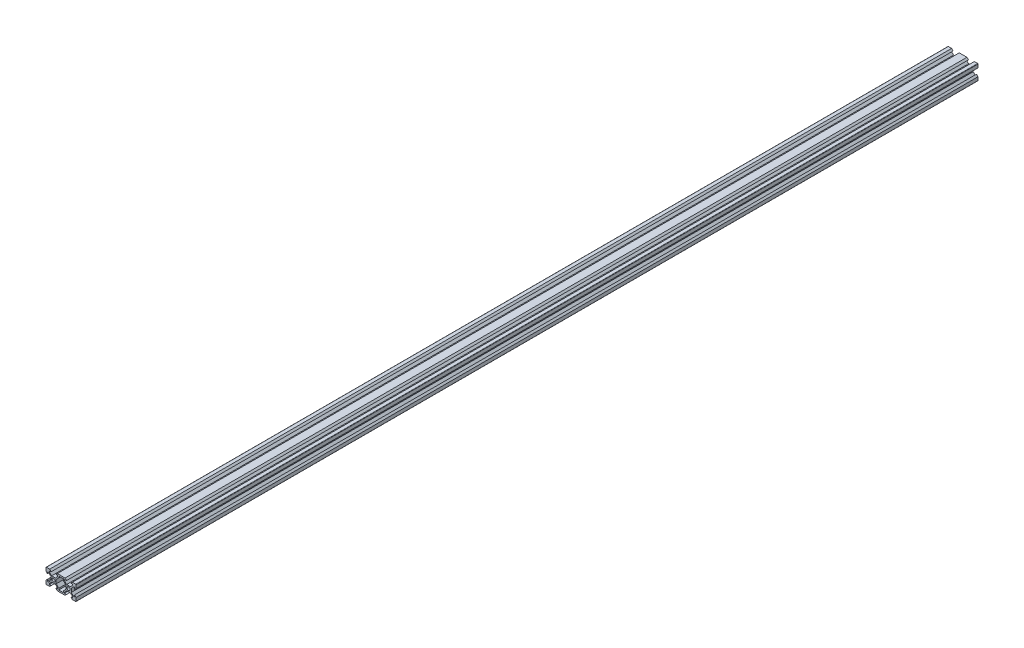
from build123d import *

# Parameters (mm, degrees)
SKETCH1_R           = 2.1
BOSS_EXTRUDE1_DEPTH = 1200
FILLET1_R           = 0.5


with BuildPart() as part:
    # Sketch1 → Boss-Extrude1 (new body)
    with BuildSketch(Plane.XY):
        Polygon((-20, -10), (-15.5, -10), (-15.1, -10), (-13.1, -8), (-15.5, -8), (-15.5, -6.560660172), (-12.539339828, -3.6), (-7.460660172, -3.6), (-4.5, -6.560660172), (-4.5, -8), (-6.9, -8), (-4.9, -10), (5.313777138, -10), (7.313777138, -8), (4.5, -8), (4.5, -6.560660172), (7.460660172, -3.6), (12.539339828, -3.6), (15.5, -6.560660172), (15.5, -8), (13.513777138, -8), (15.1, -10), (15.5, -10), (20, -10), (20, -5.5), (20, -5.1), (18, -3.1), (18, -5.5), (16.560660172, -5.5), (13.6, -2.539339828), (13.6, 2.539339828), (16.560660172, 5.5), (18, 5.5), (18, 3.1), (20, 5.1), (20, 5.5), (20, 10), (15.5, 10), (15.1, 10), (13.1, 8), (15.5, 8), (15.5, 6.560660172), (12.539339828, 3.6), (7.460660172, 3.6), (4.5, 6.560660172), (4.5, 8), (7.313777138, 8), (5.313777138, 10), (-4.9, 10), (-6.9, 8), (-4.5, 8), (-4.5, 6.560660172), (-7.460660172, 3.6), (-12.539339828, 3.6), (-15.5, 6.560660172), (-15.5, 8), (-13.1, 8), (-15.1, 10), (-15.5, 10), (-20, 10), (-20, 5.5), (-20, 5.1), (-18, 3.1), (-18, 5.5), (-16.560660172, 5.5), (-13.6, 2.539339828), (-13.6, -2.539339828), (-16.560660172, -5.5), (-18, -5.5), (-18, -3.1), (-20, -5.1), (-20, -5.5), align=None)
        with Locations((-10, 0)):
            Circle(SKETCH1_R, mode=Mode.SUBTRACT)
        with Locations((10, 0)):
            Circle(SKETCH1_R, mode=Mode.SUBTRACT)
        Polygon((3, -5.939339828), (3, -8), (-3, -8), (-3, -5.939339828), (-6.4, -2.539339828), (-6.4, 2.539339828), (-3, 5.939339828), (-3, 8), (3, 8), (3, 5.939339828), (6.4, 2.539339828), (6.4, -2.539339828), align=None, mode=Mode.SUBTRACT)
    extrude(amount=BOSS_EXTRUDE1_DEPTH)

    # Fillet1
    fillet1_edges = [part.edges().sort_by_distance(p)[0] for p in [
        (-20, 10, 600),
        (20, 10, 600),
        (20, -10, 600),
        (-20, -10, 600),
    ]]
    fillet(fillet1_edges, radius=FILLET1_R)


solid = part.part
